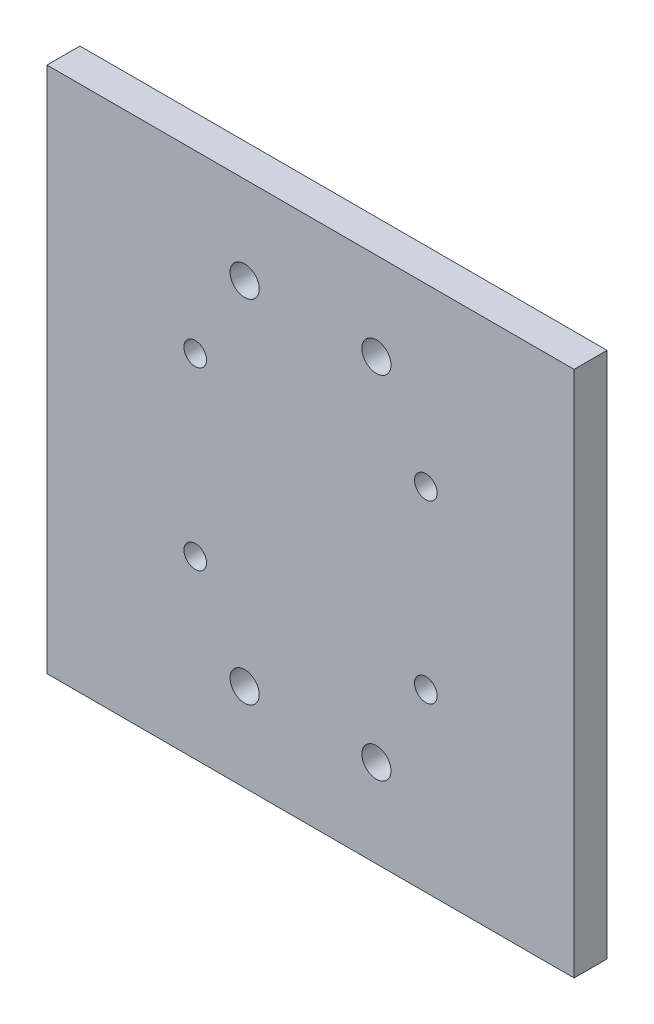
from build123d import *

# Parameters (mm, degrees)
SKETCH1_W                = 152.4
SKETCH1_H                = 152.4
BOSS_EXTRUDE1_DEPTH      = 9.525
F_5_16_18_TAPPED_HOLE1_D = 6.5278
F_5_16_CLEARANCE_HOLE1_D = 8.4328


with BuildPart() as part:
    # Sketch1 → Boss-Extrude1 (new body)
    with BuildSketch(Plane.XY):
        with Locations((76.2, 76.2)):
            Rectangle(SKETCH1_W, SKETCH1_H)
    extrude(amount=BOSS_EXTRUDE1_DEPTH)

    # 5/16-18 Tapped Hole1 (through all)
    with Locations(Plane.XY.offset(9.525)):
        with Locations((109.5375, 101.6), (42.8625, 101.6), (109.5375, 50.8), (42.8625, 50.8)):
            Hole(F_5_16_18_TAPPED_HOLE1_D / 2)

    # 5/16 Clearance Hole1 (through all)
    with Locations(Plane.XY.offset(9.525)):
        with Locations((95.25, 127), (57.15, 127), (95.25, 25.4), (57.15, 25.4)):
            Hole(F_5_16_CLEARANCE_HOLE1_D / 2)


solid = part.part
